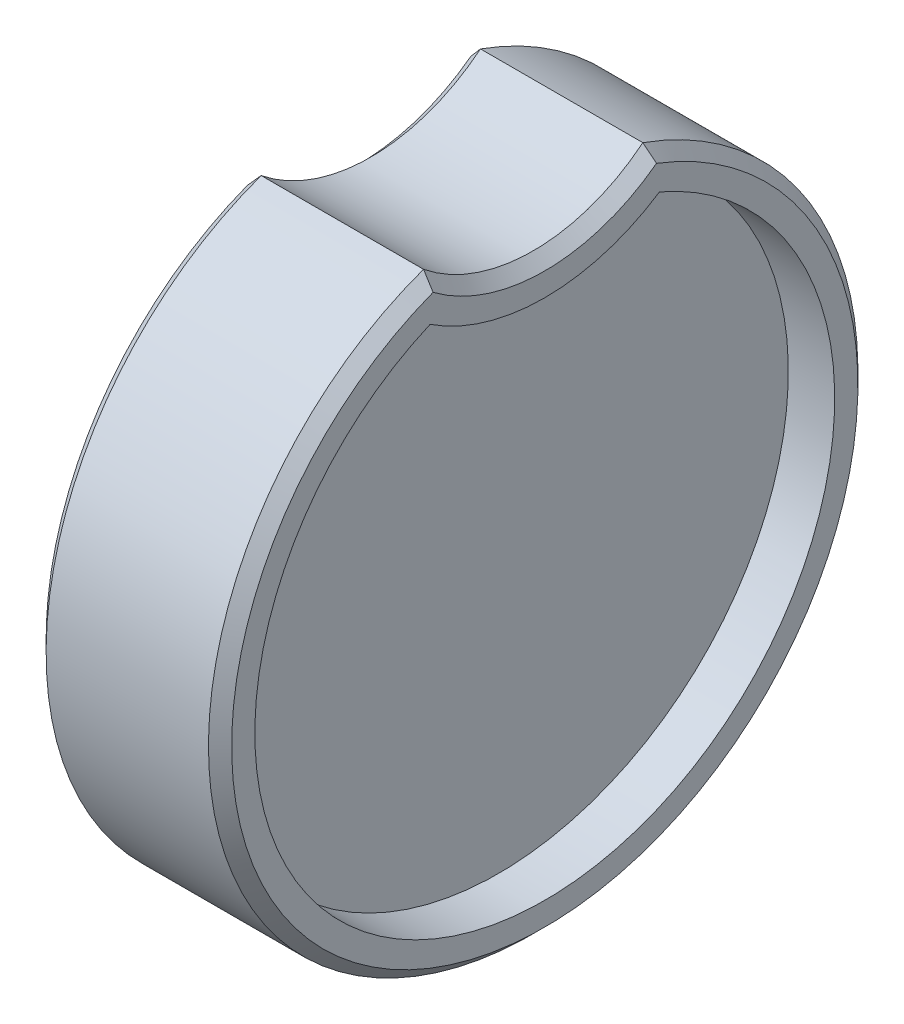
from build123d import *

# Parameters (mm, degrees)
SKETCH1_R           = 28
BOSS_EXTRUDE1_DEPTH = 8
SKETCH2_R           = 15
CUT_EXTRUDE1_DEPTH  = 43.708313008
CHAMFER1_SIZE       = 1
CUT_EXTRUDE2_DEPTH  = 4


with BuildPart() as part:
    # Sketch1 → Boss-Extrude1 (new, symmetric)
    with BuildSketch(Plane(origin=(0, 0, 0), x_dir=(0, 0, -1), z_dir=(1, 0, 0))):
        Circle(SKETCH1_R)
    extrude(amount=BOSS_EXTRUDE1_DEPTH, both=True)

    # Sketch2 → Cut-Extrude1 (cut, through all)
    with BuildSketch(Plane(origin=(8, 0, 0), x_dir=(0, 0, -1), z_dir=(1, 0, 0))):
        with Locations((0, 38)):
            Circle(SKETCH2_R)
    extrude(amount=-CUT_EXTRUDE1_DEPTH, mode=Mode.SUBTRACT)

    # Chamfer1
    chamfer1_edges = [part.edges().sort_by_distance(p)[0] for p in [
        (-8, -28, 0),
        (8, -28, 0),
        (8, 23, 0),
        (-8, 23, 0),
    ]]
    chamfer(chamfer1_edges, length=CHAMFER1_SIZE)

    # Sketch3 → Cut-Extrude2 (cut)
    with BuildSketch(Plane(origin=(8, 0, 0), x_dir=(0, 0, -1), z_dir=(1, 0, 0))):
        with BuildLine():
            ThreePointArc((-9.89010775, 22.960526316), (0, -25), (9.89010775, 22.960526316))
            ThreePointArc((9.89010775, 22.960526316), (0, 20), (-9.89010775, 22.960526316))
        make_face()
    cut_extrude2 = extrude(amount=-CUT_EXTRUDE2_DEPTH, mode=Mode.SUBTRACT)

    # Mirror1: Cut-Extrude2 across plane
    add(cut_extrude2.mirror(Plane(origin=(0, 0, 0), x_dir=(0, 0, 1), z_dir=(1, 0, 0))), mode=Mode.SUBTRACT)


solid = part.part
